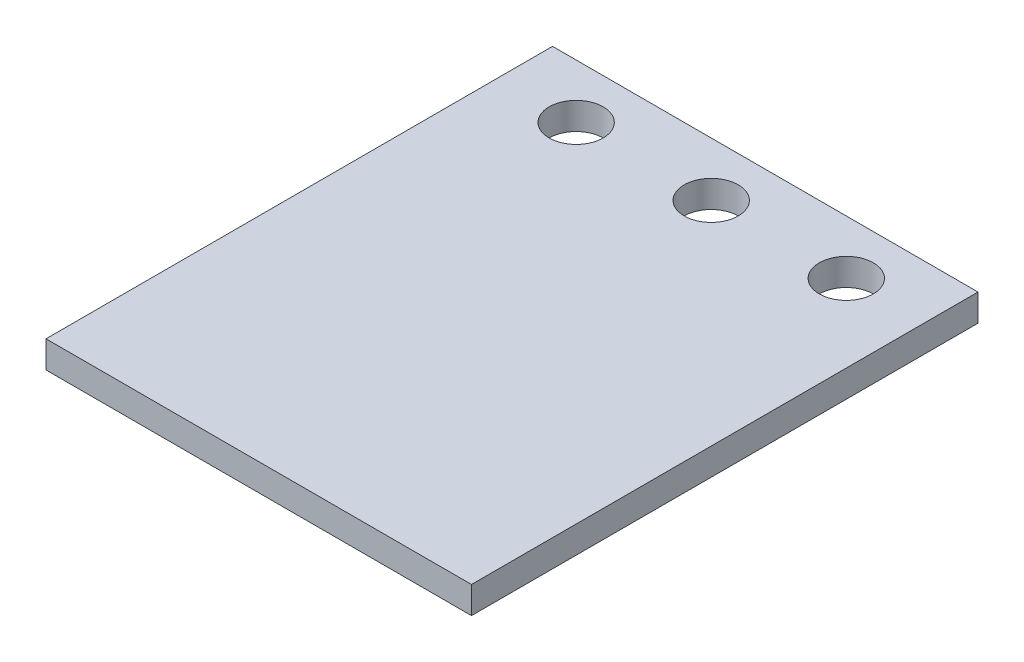
from build123d import *

# Parameters (mm, degrees)
CROQUIS2_W              = 315
CROQUIS2_H              = 20
SALIENTE_EXTRUIR1_DEPTH = 375
CORTAR_EXTRUIR1_REACH   = 398.622
CROQUIS3_R              = 20


with BuildPart() as part:
    # Croquis2 → Saliente-Extruir1 (new body)
    with BuildSketch(Plane(origin=(0, 0, 360), x_dir=(-1, 0, 0), z_dir=(0, 0, -1))):
        with Locations((7.754092983, 192.834413862)):
            Rectangle(CROQUIS2_W, CROQUIS2_H)
    extrude(amount=SALIENTE_EXTRUIR1_DEPTH)

    # Croquis3 → Cortar-Extruir1 (cut, up to next)
    with BuildSketch(Plane(origin=(0, 202.834413862, 0), x_dir=(1, 0, 0), z_dir=(0, 1, 0)), mode=Mode.PRIVATE) as cortar_extruir1_sk1:
        with Locations(Location((-107.754092983, -25, 0), (0, 0, 270))):
            Circle(CROQUIS3_R)
    cortar_extruir1_tool1 = extrude(cortar_extruir1_sk1.sketch, amount=-CORTAR_EXTRUIR1_REACH, mode=Mode.PRIVATE) & part.part
    # Croquis3 → Cortar-Extruir1 (cut, up to next)
    with BuildSketch(Plane(origin=(0, 202.834413862, 0), x_dir=(1, 0, 0), z_dir=(0, 1, 0)), mode=Mode.PRIVATE) as cortar_extruir1_sk2:
        with Locations(Location((-7.754092983, -25, 0), (0, 0, 270))):
            Circle(CROQUIS3_R)
    cortar_extruir1_tool2 = extrude(cortar_extruir1_sk2.sketch, amount=-CORTAR_EXTRUIR1_REACH, mode=Mode.PRIVATE) & part.part
    # Croquis3 → Cortar-Extruir1 (cut, up to next)
    with BuildSketch(Plane(origin=(0, 202.834413862, 0), x_dir=(1, 0, 0), z_dir=(0, 1, 0)), mode=Mode.PRIVATE) as cortar_extruir1_sk3:
        with Locations(Location((92.245907017, -25, 0), (0, 0, 270))):
            Circle(CROQUIS3_R)
    cortar_extruir1_tool3 = extrude(cortar_extruir1_sk3.sketch, amount=-CORTAR_EXTRUIR1_REACH, mode=Mode.PRIVATE) & part.part
    add(cortar_extruir1_tool1.solids().sort_by_distance((-107.754093, 202.834414, 25))[0], mode=Mode.SUBTRACT)
    add(cortar_extruir1_tool2.solids().sort_by_distance((-7.754093, 202.834414, 25))[0], mode=Mode.SUBTRACT)
    add(cortar_extruir1_tool3.solids().sort_by_distance((92.245907, 202.834414, 25))[0], mode=Mode.SUBTRACT)


solid = part.part
